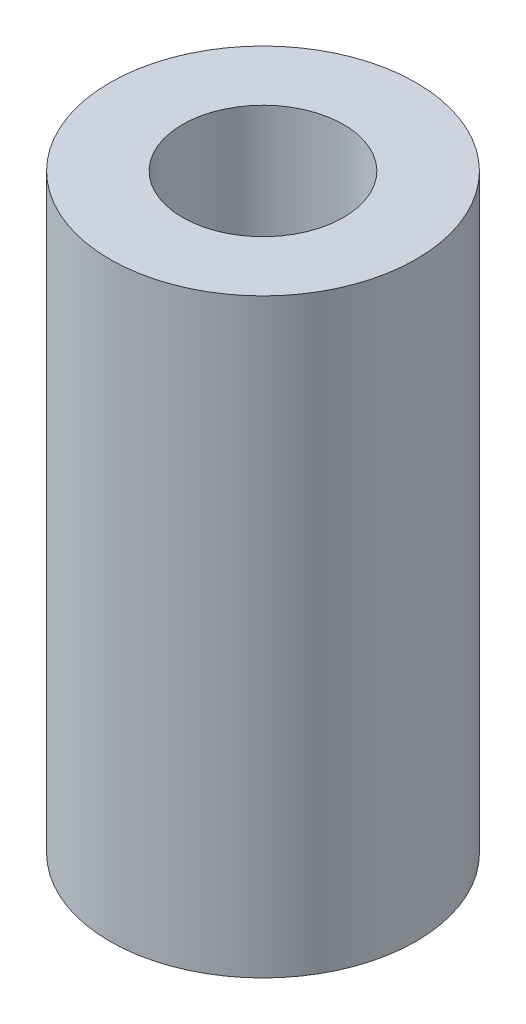
from build123d import *

# Parameters (mm, degrees)
SKETCH1_R           = 2.85
SKETCH1_R_2         = 1.25
BOSS_EXTRUDE1_DEPTH = 11
CUT_EXTRUDE1_START  = 6
SKETCH2_R           = 1.5
CUT_EXTRUDE1_DEPTH  = 6


with BuildPart() as part:
    # Sketch1 → Boss-Extrude1 (new body)
    with BuildSketch(Plane(origin=(0, 0, 0), x_dir=(1, 0, 0), z_dir=(0, 1, 0))):
        with Locations(Location((0, 0, 0), (0, 0, 270))):
            Circle(SKETCH1_R)
        with Locations(Location((0, 0, 0), (0, 0, 270))):
            Circle(SKETCH1_R_2, mode=Mode.SUBTRACT)
    extrude(amount=BOSS_EXTRUDE1_DEPTH)

    # Sketch2 → Cut-Extrude1 (cut)
    with BuildSketch(Plane(origin=(0, 0, 0), x_dir=(1, 0, 0), z_dir=(0, 1, 0)).offset(CUT_EXTRUDE1_START)):
        with Locations(Location((0, 0, 0), (0, 0, 270))):
            Circle(SKETCH2_R)
    extrude(amount=CUT_EXTRUDE1_DEPTH, mode=Mode.SUBTRACT)


solid = part.part
